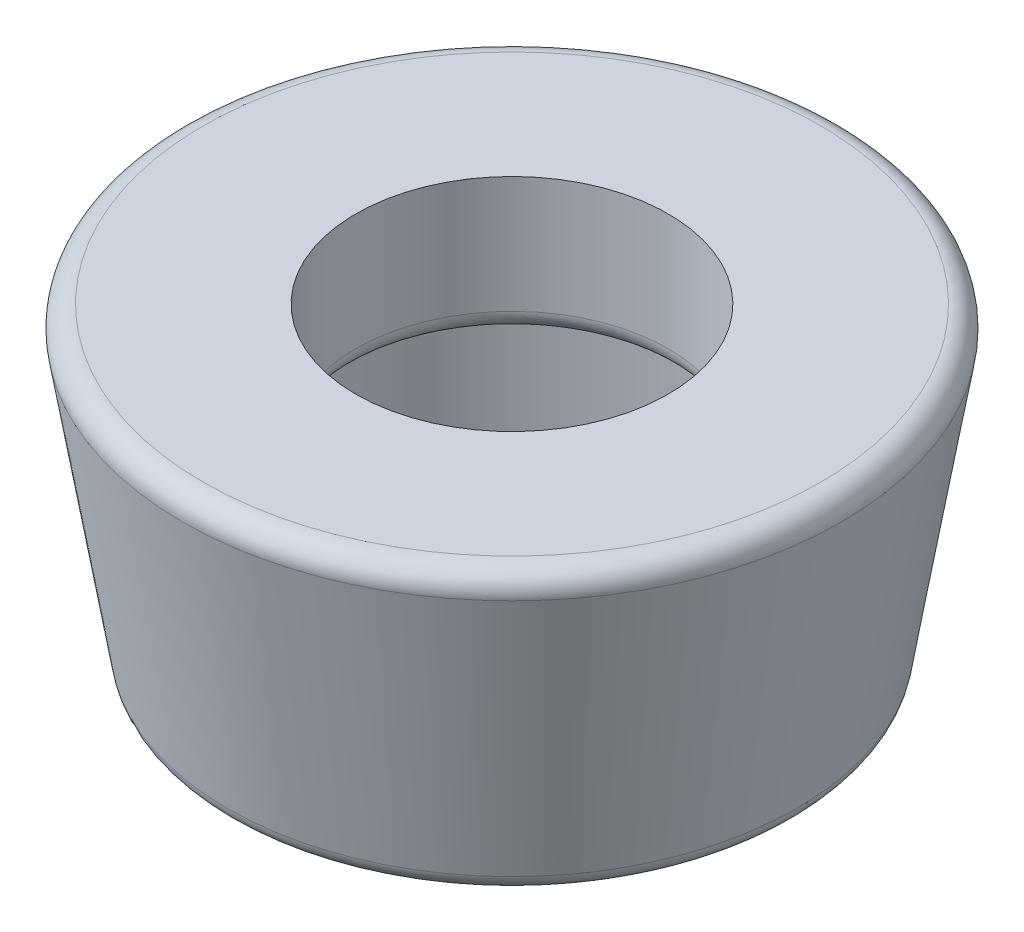
from build123d import *


with BuildPart() as part:
    # Sketch1 → Revolve1 (revolve)
    with BuildSketch(Plane.XY, mode=Mode.PRIVATE) as revolve1_sk:
        with BuildLine():
            Line((1.5, 0), (2.963907916, 0))
            ThreePointArc((2.963907916, 0), (3.116511912, -0.070725021), (3.1611867, -0.232879797))
            Line((3.1611867, -0.232879797), (2.727853367, -2.832879797))
            ThreePointArc((2.727853367, -2.832879797), (2.659849562, -2.952603996), (2.530574582, -3))
            Line((2.530574582, -3), (2.2, -3))
            Line((2.2, -3), (2.2, -1.32133537))
            Line((2.2, -1.32133537), (1.7, -1.32133537))
            ThreePointArc((1.7, -1.32133537), (1.558578644, -1.262756726), (1.5, -1.12133537))
            Line((1.5, -1.12133537), (1.5, 0))
        make_face()
    revolve(revolve1_sk.sketch.rotate(Axis((0, 1.955447774, 0), (0, -1, 0)), 90), axis=Axis((0, 1.955447774, 0), (0, -1, 0)))


solid = part.part
